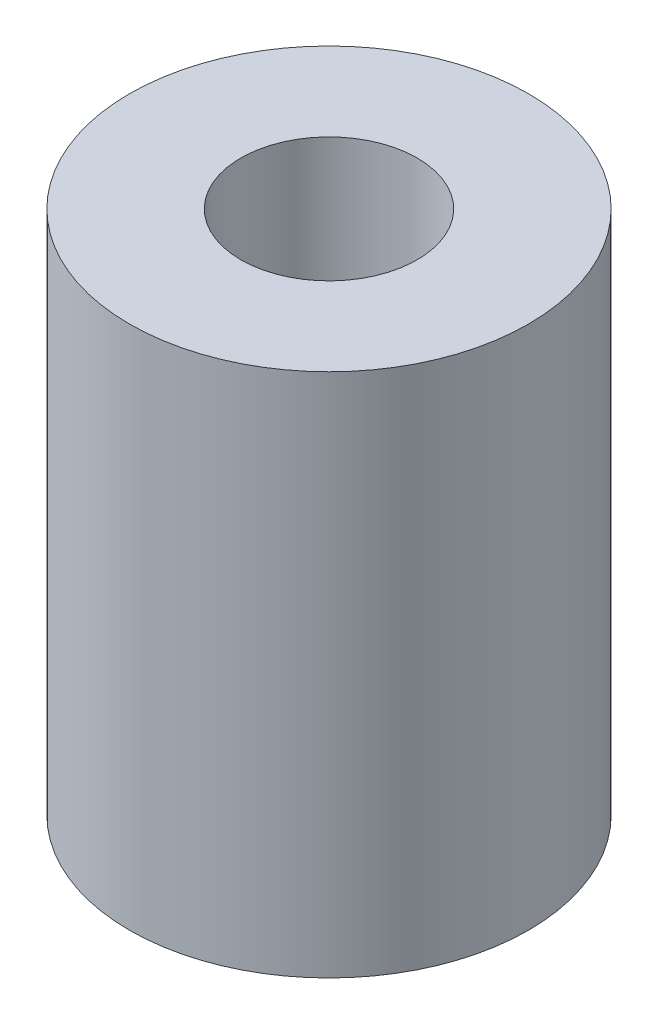
from build123d import *

# Parameters (mm, degrees)
SKETCH1_R           = 9.5
SKETCH1_R_2         = 3.2
BOSS_EXTRUDE1_DEPTH = 25
SKETCH2_R           = 4.2
CUT_EXTRUDE1_DEPTH  = 12.5


with BuildPart() as part:
    # Sketch1 → Boss-Extrude1 (new body)
    with BuildSketch(Plane(origin=(0, 0, 0), x_dir=(1, 0, 0), z_dir=(0, 1, 0))):
        with Locations(Location((0, 0, 0), (0, 0, 270))):
            Circle(SKETCH1_R)
        with Locations(Location((0, 0, 0), (0, 0, 270))):
            Circle(SKETCH1_R_2, mode=Mode.SUBTRACT)
    extrude(amount=BOSS_EXTRUDE1_DEPTH)

    # Sketch2 → Cut-Extrude1 (cut)
    with BuildSketch(Plane(origin=(0, 25, 0), x_dir=(1, 0, 0), z_dir=(0, 1, 0))):
        with Locations(Location((0, 0, 0), (0, 0, 270))):
            Circle(SKETCH2_R)
    extrude(amount=-CUT_EXTRUDE1_DEPTH, mode=Mode.SUBTRACT)


solid = part.part
